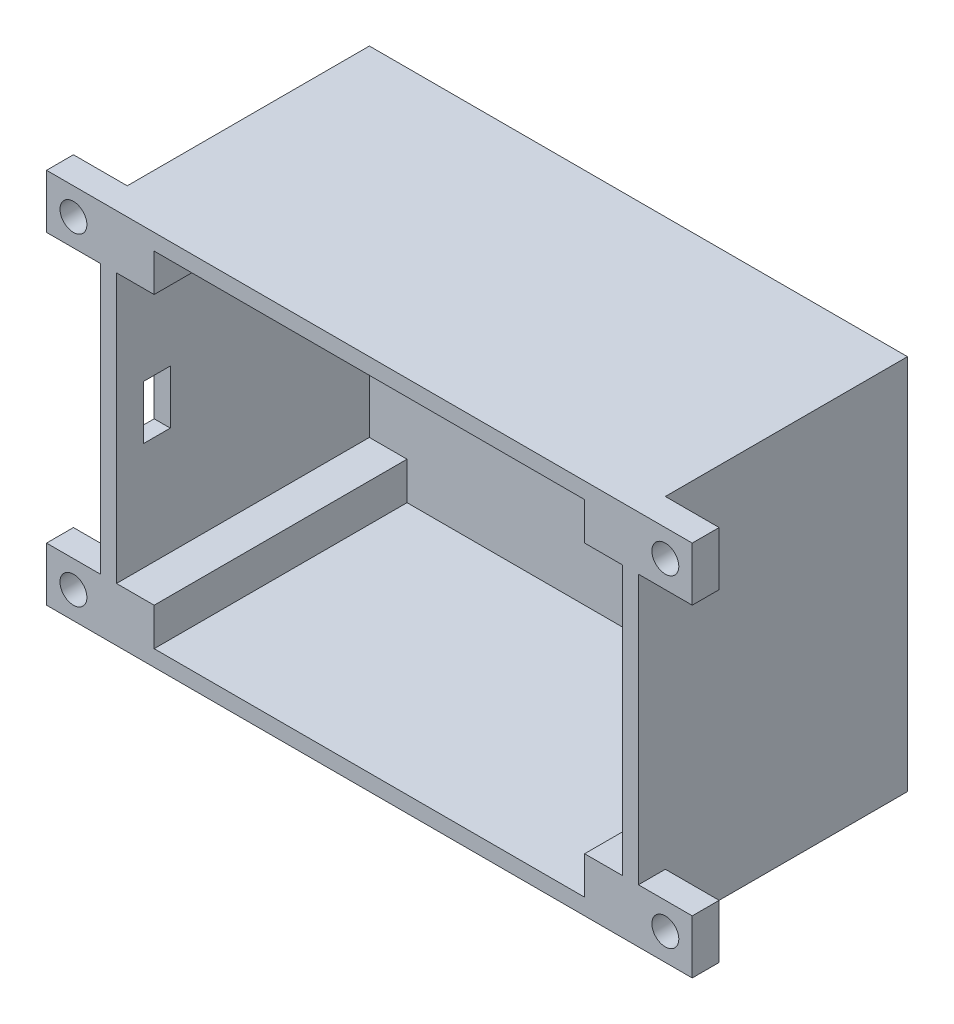
from build123d import *

# Parameters (mm, degrees)
ESQUISSE1_W             = 100
ESQUISSE1_H             = 70
BOSS_EXTRU_1_DEPTH      = 50
ESQUISSE2_W             = 94
ESQUISSE2_H             = 64
ENL_V_MAT_EXTRU_1_DEPTH = 47
ESQUISSE4_W             = 15
ESQUISSE4_H             = 10
ENL_V_MAT_EXTRU_3_DEPTH = 47
ESQUISSE5_W             = 20
ESQUISSE5_H             = 10
BOSS_EXTRU_2_DEPTH      = 50
ESQUISSE6_W             = 10
ESQUISSE6_H             = 10
ENL_V_MAT_EXTRU_4_DEPTH = 45
ESQUISSE7_R             = 2.5
ENL_V_MAT_EXTRU_5_DEPTH = 45
ESQUISSE3_W             = 5
ESQUISSE3_H             = 10
ENL_V_MAT_EXTRU_6_DEPTH = 45


with BuildPart() as part:
    # Esquisse1 → Boss.-Extru.1 (new body)
    with BuildSketch(Plane.XY):
        with Locations((-50, 35)):
            Rectangle(ESQUISSE1_W, ESQUISSE1_H)
    extrude(amount=BOSS_EXTRU_1_DEPTH)

    # Esquisse2 → Enlèv. mat.-Extru.1 (cut)
    with BuildSketch(Plane.XY.offset(50)):
        with Locations((-50, 35)):
            Rectangle(ESQUISSE2_W, ESQUISSE2_H)
    extrude(amount=-ENL_V_MAT_EXTRU_1_DEPTH, mode=Mode.SUBTRACT)

    # Esquisse4 → Enlèv. mat.-Extru.3 (cut)
    with BuildSketch(Plane(origin=(0, 0, 0), x_dir=(-1, 0, 0), z_dir=(0, 0, -1))):
        with Locations((50, 35)):
            Rectangle(ESQUISSE4_W, ESQUISSE4_H)
    extrude(amount=-ENL_V_MAT_EXTRU_3_DEPTH, mode=Mode.SUBTRACT)

    # Esquisse5 → Boss.-Extru.2 (add)
    with BuildSketch(Plane(origin=(0, 0, 0), x_dir=(-1, 0, 0), z_dir=(0, 0, -1))):
        with Locations((0, 5)):
            Rectangle(ESQUISSE5_W, ESQUISSE5_H)
        with Locations((0, 65)):
            Rectangle(ESQUISSE5_W, ESQUISSE5_H)
        with Locations((100, 5)):
            Rectangle(ESQUISSE5_W, ESQUISSE5_H)
        with Locations((100, 65)):
            Rectangle(ESQUISSE5_W, ESQUISSE5_H)
    extrude(amount=-BOSS_EXTRU_2_DEPTH)

    # Esquisse6 → Enlèv. mat.-Extru.4 (cut)
    with BuildSketch(Plane(origin=(0, 0, 0), x_dir=(-1, 0, 0), z_dir=(0, 0, -1))):
        with Locations((-5, 65)):
            Rectangle(ESQUISSE6_W, ESQUISSE6_H)
        with Locations((-5, 5)):
            Rectangle(ESQUISSE6_W, ESQUISSE6_H)
        with Locations((105, 65)):
            Rectangle(ESQUISSE6_W, ESQUISSE6_H)
        with Locations((105, 5)):
            Rectangle(ESQUISSE6_W, ESQUISSE6_H)
    extrude(amount=-ENL_V_MAT_EXTRU_4_DEPTH, mode=Mode.SUBTRACT)

    # Esquisse7 → Enlèv. mat.-Extru.5 (cut)
    with BuildSketch(Plane(origin=(0, 0, 45), x_dir=(-1, 0, 0), z_dir=(0, 0, -1))):
        with Locations((-5, 65)):
            Circle(ESQUISSE7_R)
        with Locations((-5, 5)):
            Circle(ESQUISSE7_R)
        with Locations((105, 5)):
            Circle(ESQUISSE7_R)
        with Locations((105, 65)):
            Circle(ESQUISSE7_R)
    extrude(amount=-ENL_V_MAT_EXTRU_5_DEPTH, mode=Mode.SUBTRACT)

    # Esquisse3 → Enlèv. mat.-Extru.6 (cut)
    with BuildSketch(Plane.ZY.offset(100)):
        with Locations((42.5, 35)):
            Rectangle(ESQUISSE3_W, ESQUISSE3_H)
    extrude(amount=-ENL_V_MAT_EXTRU_6_DEPTH, mode=Mode.SUBTRACT)


solid = part.part
